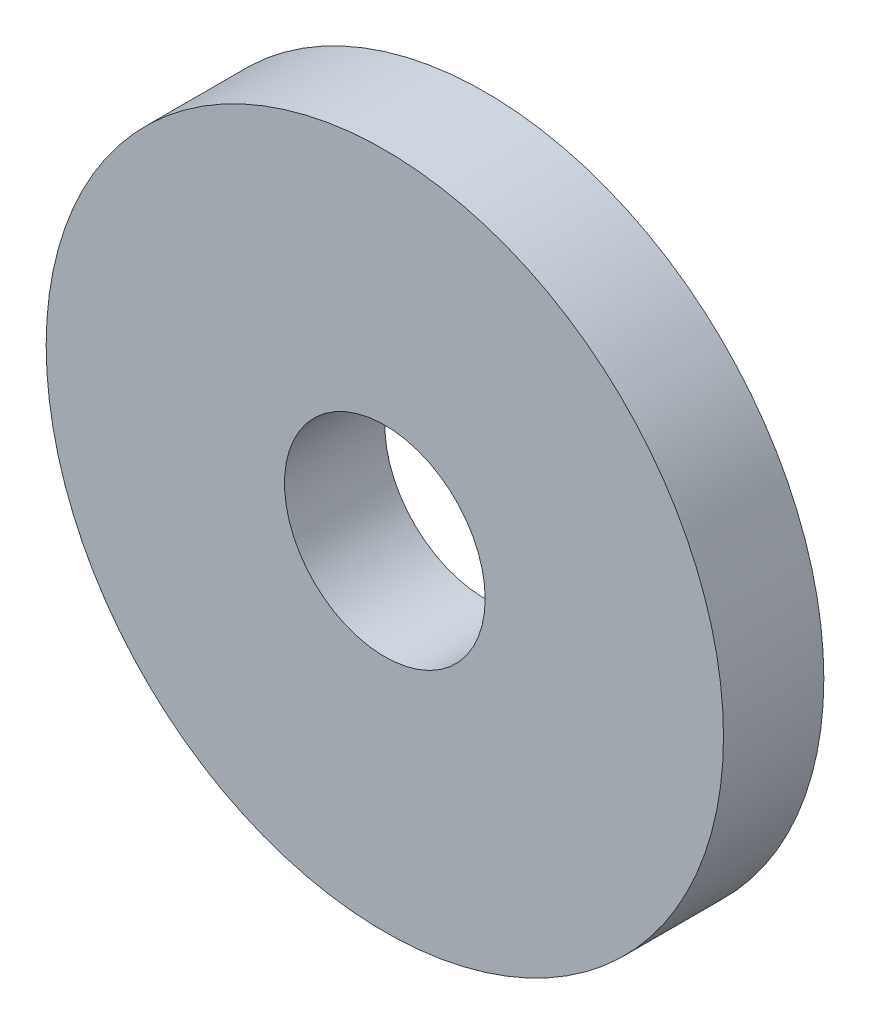
from build123d import *

# Parameters (mm, degrees)
SKETCH1_R           = 13.5
SKETCH1_R_2         = 4
BOSS_EXTRUDE1_DEPTH = 4


with BuildPart() as part:
    # Sketch1 → Boss-Extrude1 (new body)
    with BuildSketch(Plane.XY):
        Circle(SKETCH1_R)
        Circle(SKETCH1_R_2, mode=Mode.SUBTRACT)
    extrude(amount=BOSS_EXTRUDE1_DEPTH)


solid = part.part
